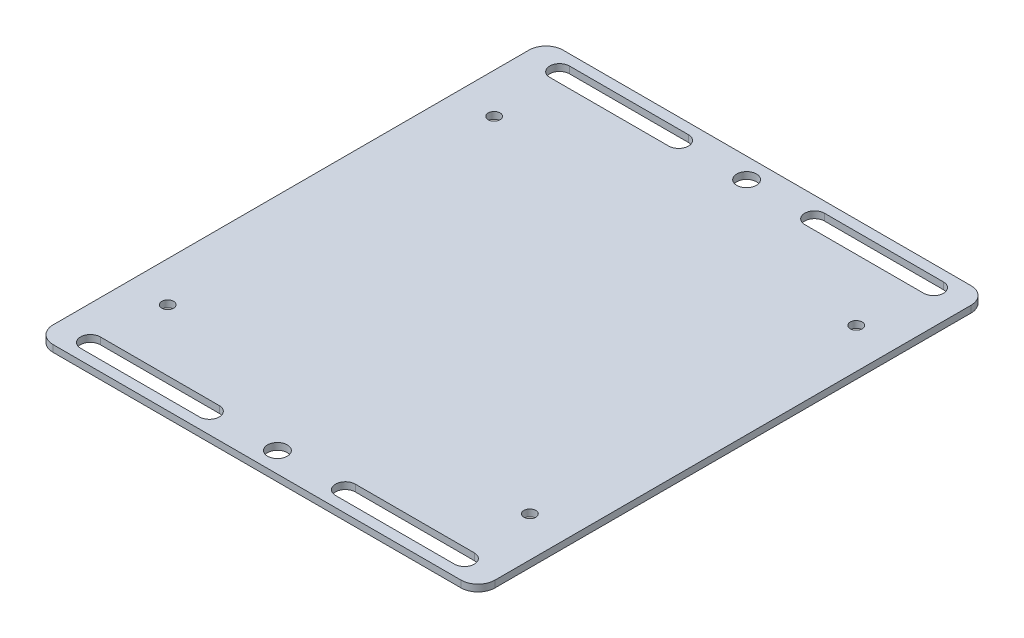
from build123d import *

# Parameters (mm, degrees)
SKETCH1_W           = 130
SKETCH1_H           = 150
BOSS_EXTRUDE1_DEPTH = 2
SKETCH2_R           = 2.9
CUT_EXTRUDE1_DEPTH  = 100.26731587
FILLET1_R           = 5
SKETCH4_R           = 1.75
CUT_EXTRUDE2_DEPTH  = 100.26731587


with BuildPart() as part:
    # Sketch1 → Boss-Extrude1 (new body)
    with BuildSketch(Plane(origin=(0, 0, 0), x_dir=(1, 0, 0), z_dir=(0, 1, 0))):
        Rectangle(SKETCH1_W, SKETCH1_H)
    extrude(amount=BOSS_EXTRUDE1_DEPTH)

    # Sketch2 → Cut-Extrude1 (cut, through all)
    with BuildSketch(Plane(origin=(0, 2, 0), x_dir=(1, 0, 0), z_dir=(0, 1, 0))):
        with Locations(Location((0, 69, 0), (0, 0, 270))):
            Circle(SKETCH2_R)
        with BuildLine():
            Line((-55, 71.9), (-20, 71.9))
            ThreePointArc((-20, 71.9), (-17.1, 69), (-20, 66.1))
            Line((-20, 66.1), (-55, 66.1))
            ThreePointArc((-55, 66.1), (-57.9, 69), (-55, 71.9))
        make_face()
        with BuildLine():
            Line((20, 71.9), (55, 71.9))
            ThreePointArc((55, 71.9), (57.9, 69), (55, 66.1))
            Line((55, 66.1), (20, 66.1))
            ThreePointArc((20, 66.1), (17.1, 69), (20, 71.9))
        make_face()
    cut_extrude1 = extrude(amount=-CUT_EXTRUDE1_DEPTH, mode=Mode.SUBTRACT)

    # Mirror1: Cut-Extrude1 across plane
    add(cut_extrude1.mirror(Plane.XY), mode=Mode.SUBTRACT)

    # Fillet1
    fillet1_edges = [part.edges().sort_by_distance(p)[0] for p in [
        (65, 1, 75),
        (-65, 1, 75),
        (-65, 1, -75),
        (65, 1, -75),
    ]]
    fillet(fillet1_edges, radius=FILLET1_R)

    # Sketch4 → Cut-Extrude2 (cut, through all)
    with BuildSketch(Plane(origin=(0, 2, 0), x_dir=(1, 0, 0), z_dir=(0, 1, 0))):
        with Locations(Location((-53.25, 48, 0), (0, 0, 270))):
            Circle(SKETCH4_R)
        with Locations(Location((53.25, 48, 0), (0, 0, 270))):
            Circle(SKETCH4_R)
        with Locations(Location((-53.25, -48, 0), (0, 0, 270))):
            Circle(SKETCH4_R)
        with Locations(Location((53.25, -48, 0), (0, 0, 270))):
            Circle(SKETCH4_R)
    extrude(amount=-CUT_EXTRUDE2_DEPTH, mode=Mode.SUBTRACT)


solid = part.part
